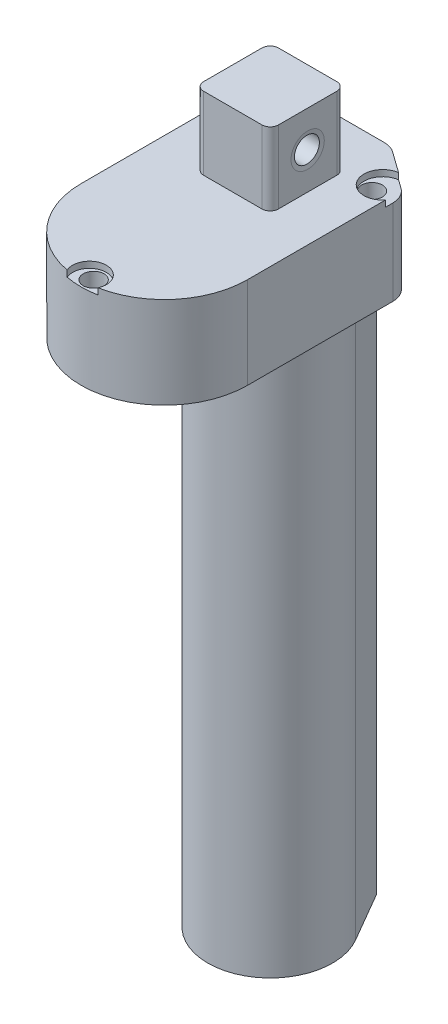
from build123d import *

# Parameters (mm, degrees)
SALIENTE_EXTRUIR1_DEPTH = 22
CROQUIS3_R              = 4.5
CROQUIS3_R_2            = 2.5
CORTAR_EXTRUIR2_DEPTH   = 1.5
CROQUIS4_R              = 2.5
CORTAR_EXTRUIR3_DEPTH   = 18
CROQUIS5_R              = 4.05861195
CORTAR_EXTRUIR4_DEPTH   = 1.5
CROQUIS6_R              = 2.5
CORTAR_EXTRUIR5_DEPTH   = 15
SALIENTE_EXTRUIR2_DEPTH = 19
CROQUIS8_R              = 3
CORTAR_EXTRUIR7_DEPTH   = 19
CROQUIS9_R              = 4
CORTAR_EXTRUIR10_DEPTH  = 0.5
CORTAR_EXTRUIR10_DRAFT  = -80
CROQUIS10_R             = 4
CORTAR_EXTRUIR11_DEPTH  = 0.5
CORTAR_EXTRUIR11_DRAFT  = -80
SALIENTE_EXTRUIR3_DEPTH = 135.5
CROQUIS12_R             = 10
CORTAR_EXTRUIR12_DEPTH  = 100


with BuildPart() as part:
    # Croquis2 → Saliente-Extruir1 (new body)
    with BuildSketch(Plane(origin=(0, 0, 0), x_dir=(1, 0, 0), z_dir=(0, 1, 0))):
        with BuildLine():
            Line((-17.906190969, 38.99557788), (-10.803865702, 44.068667356))
            ThreePointArc((-10.803865702, 44.068667356), (-9.423561888, 44.761477543), (-7.897674733, 45))
            Line((-7.897674733, 45), (7.897674733, 45))
            ThreePointArc((7.897674733, 45), (9.423561888, 44.761477543), (10.803865702, 44.068667356))
            Line((10.803865702, 44.068667356), (17.906190969, 38.99557788))
            ThreePointArc((17.906190969, 38.99557788), (19.445838214, 37.214818428), (20, 34.926910524))
            Line((20, 34.926910524), (20, 0))
            ThreePointArc((20, 0), (0, -20), (-20, 0))
            Line((-20, 0), (-20, 34.926910524))
            ThreePointArc((-20, 34.926910524), (-19.445838214, 37.214818428), (-17.906190969, 38.99557788))
        make_face()
    extrude(amount=SALIENTE_EXTRUIR1_DEPTH)

    # Croquis3 → Cortar-Extruir2 (cut)
    # profile 1 of 2: a face of its own
    with BuildSketch(Plane(origin=(0, 22, 0), x_dir=(1, 0, 0), z_dir=(0, 1, 0))):
        with Locations((-16.5, 36)):
            Circle(CROQUIS3_R)
        with Locations(Location((-15, 34.926910524, 0), (0, 0, 270))):
            Circle(CROQUIS3_R_2, mode=Mode.SUBTRACT)
    # profile 2 of 2: a face of its own
    with BuildSketch(Plane(origin=(0, 22, 0), x_dir=(1, 0, 0), z_dir=(0, 1, 0))):
        with Locations((16.5, 36)):
            Circle(CROQUIS3_R)
        with Locations(Location((15, 34.926910524, 0), (0, 0, 270))):
            Circle(CROQUIS3_R_2, mode=Mode.SUBTRACT)
    extrude(amount=-CORTAR_EXTRUIR2_DEPTH, mode=Mode.SUBTRACT)

    # Croquis4 → Cortar-Extruir3 (cut)
    with BuildSketch(Plane(origin=(0, 22, 0), x_dir=(1, 0, 0), z_dir=(0, 1, 0))):
        with Locations(Location((-15, 34.926910524, 0), (0, 0, 270))):
            Circle(CROQUIS4_R)
        with Locations(Location((15, 34.926910524, 0), (0, 0, 270))):
            Circle(CROQUIS4_R)
    extrude(amount=-CORTAR_EXTRUIR3_DEPTH, mode=Mode.SUBTRACT)

    # Croquis5 → Cortar-Extruir4 (cut)
    with BuildSketch(Plane(origin=(0, 22, 0), x_dir=(1, 0, 0), z_dir=(0, 1, 0))):
        with Locations((0.022007055, -18)):
            Circle(CROQUIS5_R)
    extrude(amount=-CORTAR_EXTRUIR4_DEPTH, mode=Mode.SUBTRACT)

    # Croquis6 → Cortar-Extruir5 (cut)
    with BuildSketch(Plane(origin=(0, 20.5, 0), x_dir=(1, 0, 0), z_dir=(0, 1, 0))):
        with Locations(Location((0.024452265, -16.999985052, 0), (0, 0, 270))):
            Circle(CROQUIS6_R)
    extrude(amount=-CORTAR_EXTRUIR5_DEPTH, mode=Mode.SUBTRACT)

    # Croquis7 → Saliente-Extruir2 (add)
    with BuildSketch(Plane(origin=(0, 20.5, 0), x_dir=(1, 0, 0), z_dir=(0, 1, 0))):
        with BuildLine():
            Line((7.003665578, 16.460210879), (-7.003665578, 16.460210879))
            ThreePointArc((-7.003665578, 16.460210879), (-8.41787914, 17.045997317), (-9.003665578, 18.460210879))
            Line((-9.003665578, 18.460210879), (-9.003665578, 32.465325191))
            ThreePointArc((-9.003665578, 32.465325191), (-8.41787914, 33.879538753), (-7.003665578, 34.465325191))
            Line((-7.003665578, 34.465325191), (7.003665578, 34.465325191))
            ThreePointArc((7.003665578, 34.465325191), (8.41787914, 33.879538753), (9.003665578, 32.465325191))
            Line((9.003665578, 32.465325191), (9.003665578, 18.460210879))
            ThreePointArc((9.003665578, 18.460210879), (8.41787914, 17.045997317), (7.003665578, 16.460210879))
        make_face()
    extrude(amount=SALIENTE_EXTRUIR2_DEPTH)

    # Croquis8 → Cortar-Extruir7 (cut)
    with BuildSketch(Plane.ZY.offset(9.003665578)):
        with Locations((-25.462768035, 30.75)):
            Circle(CROQUIS8_R)
    extrude(amount=-CORTAR_EXTRUIR7_DEPTH, mode=Mode.SUBTRACT)


with BuildPart() as cortar_extruir10_tool:
    # Croquis9 → Cortar-Extruir10 (with draft: the straight prism first)
    with BuildSketch(Plane.ZY.offset(9.003665578)):
        with Locations((-25.462768035, 30.75)):
            Circle(CROQUIS9_R)
    extrude(amount=-CORTAR_EXTRUIR10_DEPTH)
    # Cortar-Extruir10: the draft: its side faces are tilted about the plane it starts from
    cortar_extruir10_sides = [cortar_extruir10_tool.faces().sort_by_distance(p)[0] for p in [
        (-8.753665578, 30.75, -29.462768035),
    ]]
    draft(cortar_extruir10_sides, Plane.ZY.offset(9.003665578), CORTAR_EXTRUIR10_DRAFT)


with BuildPart() as part_1:
    add(part.part)

    # Cortar-Extruir10: cut by cortar_extruir10_tool
    add(cortar_extruir10_tool.part, mode=Mode.SUBTRACT)


with BuildPart() as cortar_extruir11_tool:
    # Croquis10 → Cortar-Extruir11 (with draft: the straight prism first)
    with BuildSketch(Plane(origin=(9.003665578, 0, 0), x_dir=(0, 0, -1), z_dir=(1, 0, 0))):
        with Locations((25.462768035, 30.75)):
            Circle(CROQUIS10_R)
    extrude(amount=-CORTAR_EXTRUIR11_DEPTH)
    # Cortar-Extruir11: the draft: its side faces are tilted about the plane it starts from
    cortar_extruir11_sides = [cortar_extruir11_tool.faces().sort_by_distance(p)[0] for p in [
        (8.753665578, 30.75, -21.462768035),
    ]]
    draft(cortar_extruir11_sides, Plane(origin=(9.003665578, 0, 0), x_dir=(0, 0, -1), z_dir=(1, 0, 0)), CORTAR_EXTRUIR11_DRAFT)


with BuildPart() as part_2:
    add(part_1.part)

    # Cortar-Extruir11: cut by cortar_extruir11_tool
    add(cortar_extruir11_tool.part, mode=Mode.SUBTRACT)

    # Croquis11 → Saliente-Extruir3 (add)
    with BuildSketch(Plane.XZ):
        with BuildLine():
            Line((-6, -45), (-12.97133054, -32.995668142))
            ThreePointArc((-12.97133054, -32.995668142), (0, -10.462768035), (12.97133054, -32.995668142))
            Line((12.97133054, -32.995668142), (6, -45))
            Line((6, -45), (-6, -45))
        make_face()
    extrude(amount=SALIENTE_EXTRUIR3_DEPTH)

    # Croquis12 → Cortar-Extruir12 (cut)
    with BuildSketch(Plane.XZ.offset(135.5)):
        with Locations(Location((0, -25.462768035, 0), (0, 0, 270))):
            Circle(CROQUIS12_R)
    extrude(amount=-CORTAR_EXTRUIR12_DEPTH, mode=Mode.SUBTRACT)


solid = part_2.part
